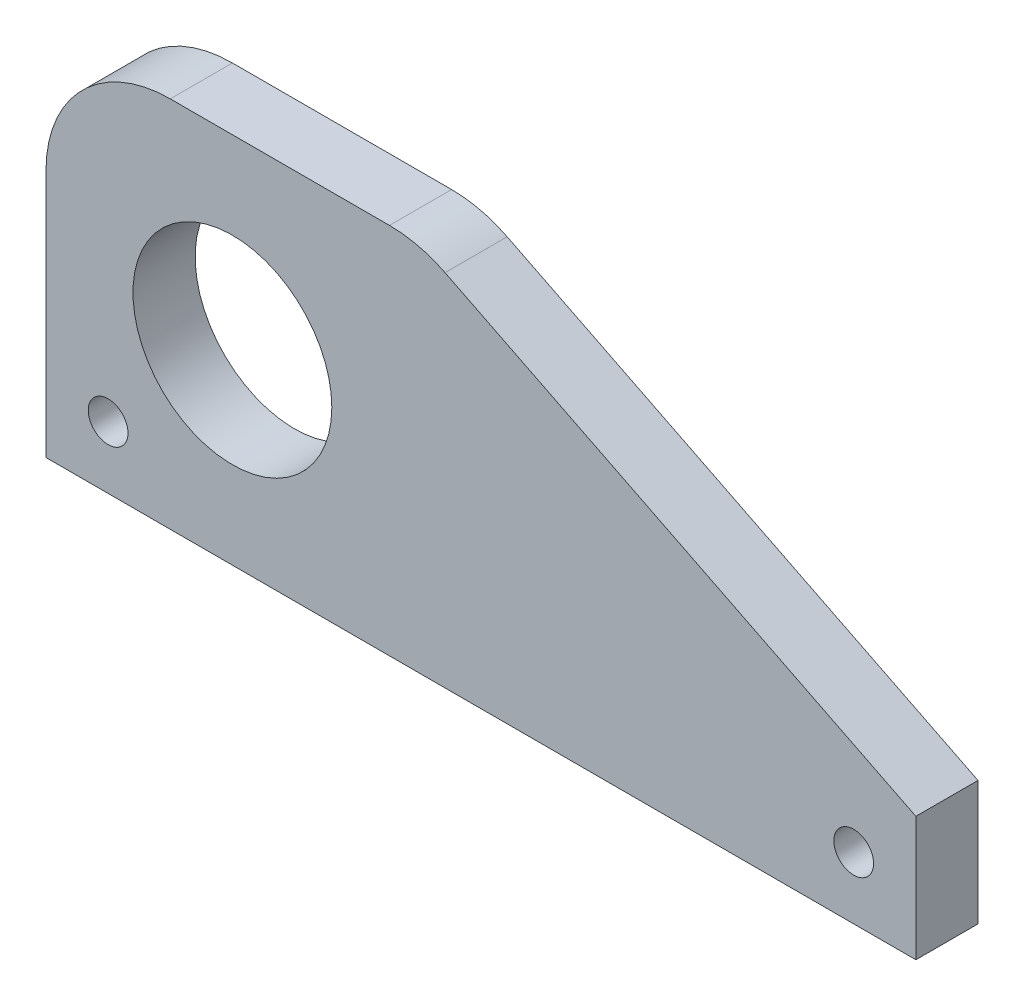
from build123d import *

# Parameters (mm, degrees)
SKETCH_1_R      = 8
SKETCH_1_R_2    = 1.6
EXTRUDE_1_DEPTH = 5
FILLET_1_R      = 10


with BuildPart() as part:
    # ｽｹｯﾁ1 → ﾎﾞｽ - 押し出し1 (new body)
    with BuildSketch(Plane.XY):
        Polygon((0, 0), (0, 10), (0, 30), (30, 30), (70, 10), (70, 0), align=None)
        with Locations((15, 15)):
            Circle(SKETCH_1_R, mode=Mode.SUBTRACT)
        with Locations((5, 5)):
            Circle(SKETCH_1_R_2, mode=Mode.SUBTRACT)
        with Locations((65, 5)):
            Circle(SKETCH_1_R_2, mode=Mode.SUBTRACT)
    extrude(amount=EXTRUDE_1_DEPTH)

    # ﾌｨﾚｯﾄ1
    fillet_1_edges = [part.edges().sort_by_distance(p)[0] for p in [
        (0, 30, 2.5),
        (30, 30, 2.5),
    ]]
    fillet(fillet_1_edges, radius=FILLET_1_R)


solid = part.part
